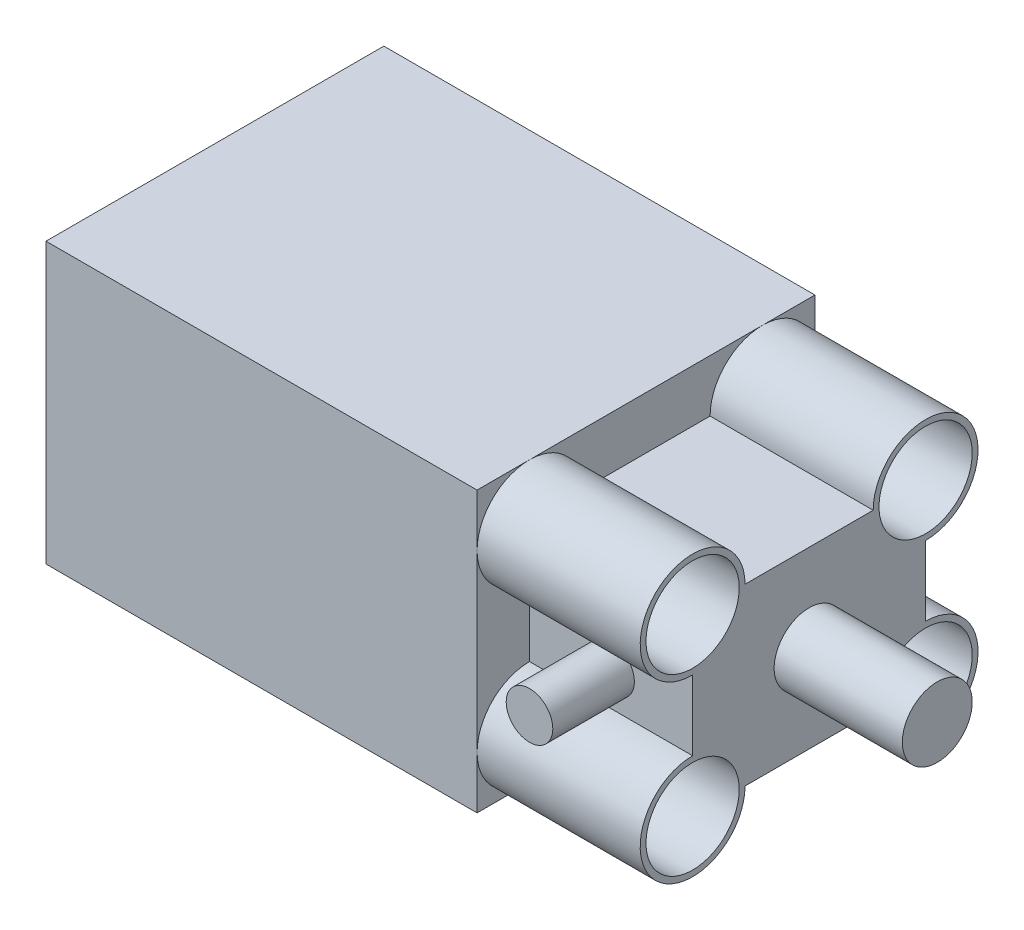
from build123d import *

# Parameters (mm, degrees)
SKETCH_1_W      = 18.5
SKETCH_1_H      = 14.5
EXTRUDE_1_DEPTH = 12
SKETCH_2_R      = 2.25
SKETCH_2_R_2    = 2
EXTRUDE_2_DEPTH = 7
SKETCH_4_R      = 1.5
EXTRUDE_3_DEPTH = 5.5
SKETCH_6_R      = 1
EXTRUDE_4_DEPTH = 3.5


with BuildPart() as part:
    # 스케치1 → 보스-돌출1 (new body)
    with BuildSketch(Plane(origin=(0, 0, 0), x_dir=(1, 0, 0), z_dir=(0, 1, 0))):
        Rectangle(SKETCH_1_W, SKETCH_1_H)
    extrude(amount=EXTRUDE_1_DEPTH)

    # 스케치2 → 보스-돌출2 (add)
    # profile 1 of 5: a face of its own
    with BuildSketch(Plane(origin=(9.25, 0, 0), x_dir=(0, 0, -1), z_dir=(1, 0, 0))):
        with Locations((-5, 9.75)):
            Circle(SKETCH_2_R)
        with Locations((-5, 9.75)):
            Circle(SKETCH_2_R_2, mode=Mode.SUBTRACT)
    # profile 2 of 5: a face of its own
    with BuildSketch(Plane(origin=(9.25, 0, 0), x_dir=(0, 0, -1), z_dir=(1, 0, 0))):
        with BuildLine():
            Line((2.75, 9.75), (-2.75, 9.75))
            ThreePointArc((-2.75, 9.75), (-3.409009742, 8.159009742), (-5, 7.5))
            Line((-5, 7.5), (-5, 4.5))
            ThreePointArc((-5, 4.5), (-3.409009742, 3.840990258), (-2.75, 2.25))
            Line((-2.75, 2.25), (2.75, 2.25))
            ThreePointArc((2.75, 2.25), (3.409009742, 3.840990258), (5, 4.5))
            Line((5, 4.5), (5, 7.5))
            ThreePointArc((5, 7.5), (3.409009742, 8.159009742), (2.75, 9.75))
        make_face()
    # profile 3 of 5: a face of its own
    with BuildSketch(Plane(origin=(9.25, 0, 0), x_dir=(0, 0, -1), z_dir=(1, 0, 0))):
        with Locations((5, 9.75)):
            Circle(SKETCH_2_R)
        with Locations((5, 9.75)):
            Circle(SKETCH_2_R_2, mode=Mode.SUBTRACT)
    # profile 4 of 5: a face of its own
    with BuildSketch(Plane(origin=(9.25, 0, 0), x_dir=(0, 0, -1), z_dir=(1, 0, 0))):
        with Locations((5, 2.25)):
            Circle(SKETCH_2_R)
        with Locations((5, 2.25)):
            Circle(SKETCH_2_R_2, mode=Mode.SUBTRACT)
    # profile 5 of 5: a face of its own
    with BuildSketch(Plane(origin=(9.25, 0, 0), x_dir=(0, 0, -1), z_dir=(1, 0, 0))):
        with Locations((-5, 2.25)):
            Circle(SKETCH_2_R)
        with Locations((-5, 2.25)):
            Circle(SKETCH_2_R_2, mode=Mode.SUBTRACT)
    extrude(amount=EXTRUDE_2_DEPTH)

    # 스케치4 → 보스-돌출3 (add)
    with BuildSketch(Plane(origin=(16.25, 0, 0), x_dir=(0, 0, -1), z_dir=(1, 0, 0))):
        with Locations((0, 6)):
            Circle(SKETCH_4_R)
    extrude(amount=EXTRUDE_3_DEPTH)

    # 스케치6 → 보스-돌출4 (add)
    with BuildSketch(Plane.XY.offset(5)):
        with Locations(Location((12.75, 6, 0), (0, 0, 180))):
            Circle(SKETCH_6_R)
    extrude(amount=EXTRUDE_4_DEPTH)


solid = part.part
